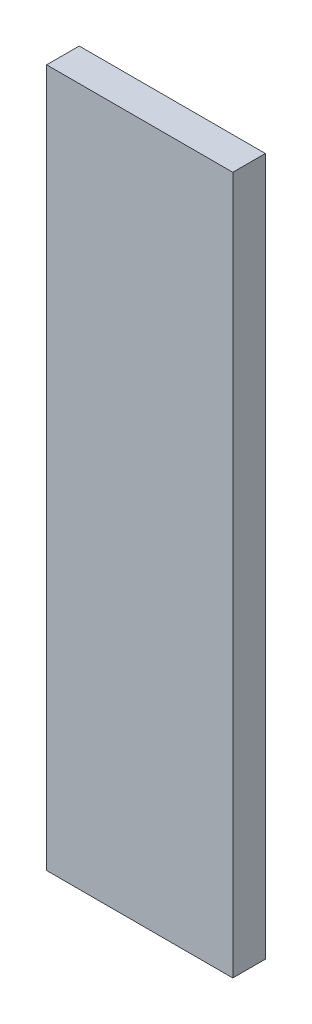
from build123d import *

# Parameters (mm, degrees)
SKETCH1_W                       = 36.27882
SKETCH1_H                       = 136.0043
EXTRUDE1_DEPTH                  = 6.35
F_3_48_TAPPED_HOLE1_D           = 1.9939
F_3_48_TAPPED_HOLE1_DEPTH       = 9.144
F_3_48_TAPPED_HOLE1_CBORE_D     = 2.5146
F_3_48_TAPPED_HOLE1_CBORE_DEPTH = 7.62
F_3_48_TAPPED_HOLE1_TIP         = 0.599027994


with BuildPart() as part:
    # Sketch1 → Extrude1 (new body)
    with BuildSketch(Plane.XY):
        Rectangle(SKETCH1_W, SKETCH1_H)
    extrude(amount=EXTRUDE1_DEPTH)

    # #3-48 Tapped Hole1
    with Locations(Plane(origin=(-14.071004552, -68.00215, 88.900648793), x_dir=(0, 0, -1), z_dir=(0, -1, 0))):
        with Locations((85.725648793, 25.860414552), (85.725648793, 0.892214552)):
            CounterBoreHole(F_3_48_TAPPED_HOLE1_D / 2, F_3_48_TAPPED_HOLE1_CBORE_D / 2, F_3_48_TAPPED_HOLE1_CBORE_DEPTH, depth=F_3_48_TAPPED_HOLE1_DEPTH)
            with Locations((0, 0, -(F_3_48_TAPPED_HOLE1_DEPTH + F_3_48_TAPPED_HOLE1_TIP / 2))):  # 118° drill point
                Cone(0, F_3_48_TAPPED_HOLE1_D / 2, F_3_48_TAPPED_HOLE1_TIP, mode=Mode.SUBTRACT)


solid = part.part
